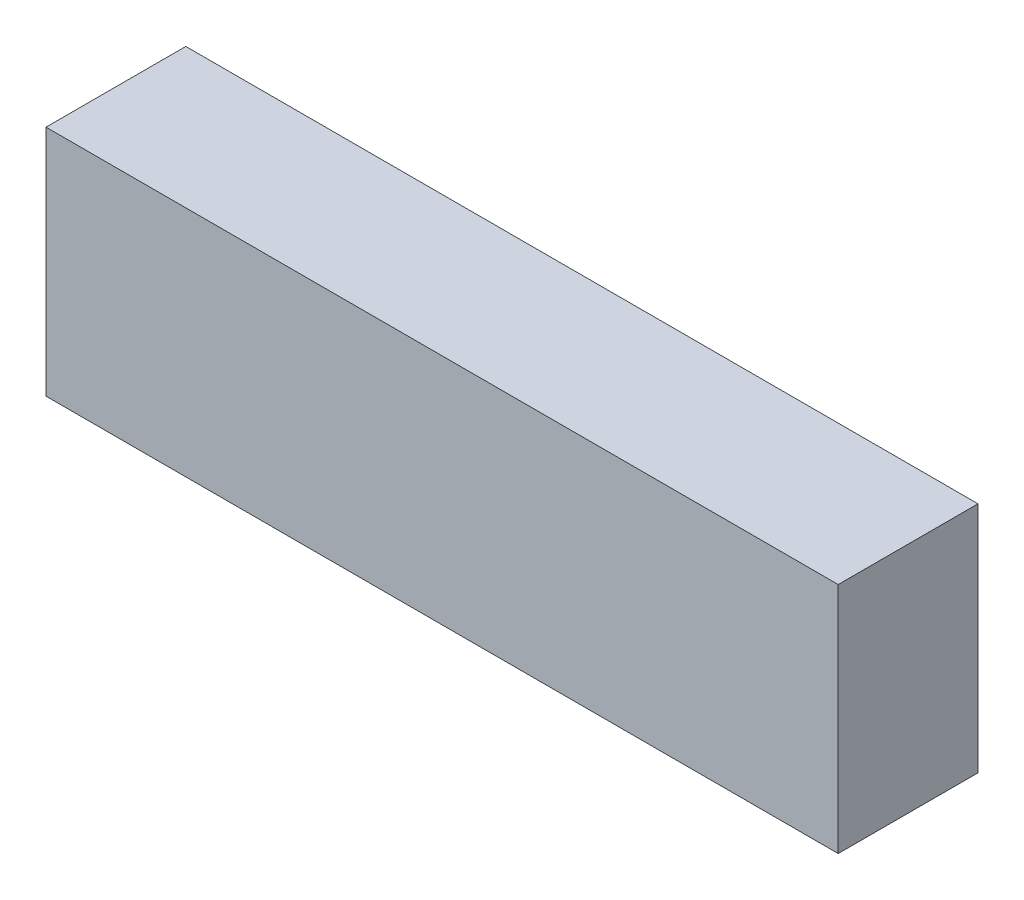
from build123d import *

# Parameters (mm, degrees)
CROQUIS2_W              = 850
CROQUIS2_H              = 250
SALIENTE_EXTRUIR1_DEPTH = 150
CROQUIS3_R              = 75
CORTAR_EXTRUIR1_DEPTH   = 50


with BuildPart() as part:
    # Croquis2 → Saliente-Extruir1 (new body)
    with BuildSketch(Plane.XY.offset(3.171613416)):
        with Locations((916.834843653, 1024.026997685)):
            Rectangle(CROQUIS2_W, CROQUIS2_H)
    extrude(amount=SALIENTE_EXTRUIR1_DEPTH)

    # Croquis3 → Cortar-Extruir1 (cut)
    with BuildSketch(Plane(origin=(0, 0, 3.171613416), x_dir=(-1, 0, 0), z_dir=(0, 0, -1))):
        with Locations((-616.834843653, 1024.026997685)):
            Circle(CROQUIS3_R)
    extrude(amount=-CORTAR_EXTRUIR1_DEPTH, mode=Mode.SUBTRACT)


solid = part.part
